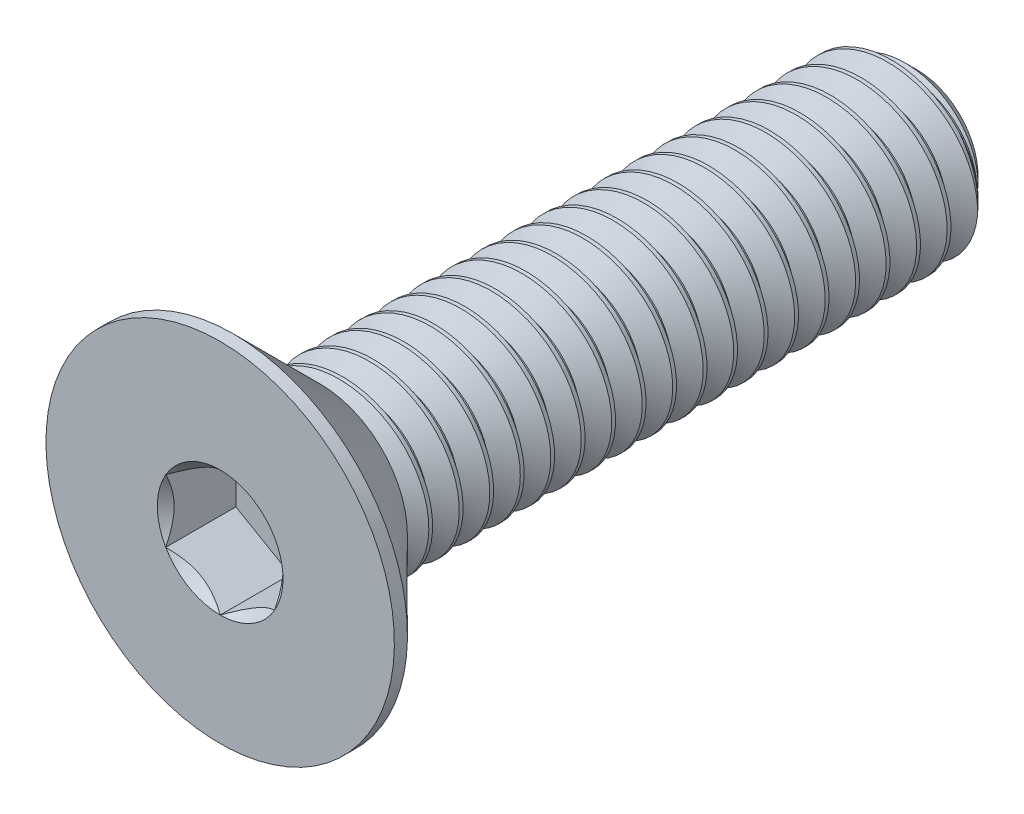
from build123d import *

# Parameters (mm, degrees)
CHAMFER1_SIZE          = 0.6
CUT_EXTRUDE1_DEPTH     = 1.61
CUT_SWEEP1_PITCH       = 0.6999999999999809
CUT_SWEEP1_HEIGHT      = 14.399999999999922
CUT_SWEEP1_RADIUS      = 1.9999999999999996
CUT_SWEEP1_START_ANGLE = -1.908e-14


with BuildPart() as part:
    # Sketch3 → Revolve1 (revolve)
    with BuildSketch(Plane(origin=(0, 0, 0), x_dir=(0, 0, -1), z_dir=(1, 0, 0))):
        Polygon((-8, 1.9999999999999982), (8, 2), (8, 6.3e-16), (-8, -1.33e-15), align=None)
    revolve(axis=Axis((0, 6.3e-16, -8), (0, -1.2e-16, 1)))

    # Chamfer1
    chamfer1_edges = [part.edges().sort_by_distance(p)[0] for p in [
        (-2.4e-16, -1.9999999999999987, -8),
    ]]
    chamfer(chamfer1_edges, length=CHAMFER1_SIZE)

    # Sketch6 → Revolve2 (revolve)
    with BuildSketch(Plane(origin=(0, 0, 0), x_dir=(0, 0, -1), z_dir=(1, 0, 0))):
        Polygon((-8, 3.999999999999999), (-7.699999999999992, 3.999999999999999), (-5.700000000000001, 2), (-5.7, -8.8e-16), (-8, -1.33e-15), align=None)
    revolve(axis=Axis((0, 6.3e-16, -8), (0, -1.2e-16, 1)))

    # Sketch8 → Cut-Extrude1 (cut)
    with BuildSketch(Plane.XY.offset(8)):
        Polygon((3.4e-16, 1.443375672974066), (-1.2500000000000002, 0.7216878364870335), (-1.2500000000000002, -0.7216878364870314), (-6e-17, -1.4433756729740639), (1.2499999999999993, -0.7216878364870325), (1.2499999999999998, 0.7216878364870339), align=None)
    extrude(amount=-CUT_EXTRUDE1_DEPTH, mode=Mode.SUBTRACT)

    # Cut-Extrude2 cone 1 section (through the dimple's axis) → Cut-Extrude2 (revolve, cut)
    with BuildSketch(Plane(origin=(0, 0, 8), x_dir=(0, -1, 0), z_dir=(1, 0, 0))):
        Polygon((0, 0), (1.443375673, 0), (0, 1.443375673), align=None)
    revolve(axis=Axis((0, 0, 8), (0, 0, -1)), mode=Mode.SUBTRACT)


with BuildPart() as body_2:
    # Split1: the piece on the far side of the plane
    add(part.part)
    split(bisect_by=Plane.XY.offset(5.7), keep=Keep.BOTTOM)

    # Cut-Sweep1: sweep along a helix
    with BuildLine() as cut_sweep1_path:
        add(Helix(CUT_SWEEP1_PITCH, CUT_SWEEP1_HEIGHT, CUT_SWEEP1_RADIUS, center=(0, -1.97e-15, -8), direction=(0, -2.8e-16, 1), mode=Mode.PRIVATE).rotate(Axis((0, -1.97e-15, -8), (0, -2.8e-16, 1)), CUT_SWEEP1_START_ANGLE))
    # Sketch10 → Cut-Sweep1 (sweep, cut)
    with BuildSketch(Plane(origin=(0, 0, 0), x_dir=(0, 0, -1), z_dir=(1, 0, 0))):
        Polygon((7.978125000000001, 2.037888611415568), (8.634375, 2.037888611415568), (8.350000000000001, 1.5453366630131684), (8.262500000000001, 1.5453366630131684), align=None)
    sweep(path=cut_sweep1_path.line, is_frenet=True, mode=Mode.SUBTRACT)


with BuildPart() as part_1:
    add(part.part)

    # Split1
    split(bisect_by=Plane.XY.offset(5.7), keep=Keep.TOP)


solid = Compound([body_2.part, part_1.part])
